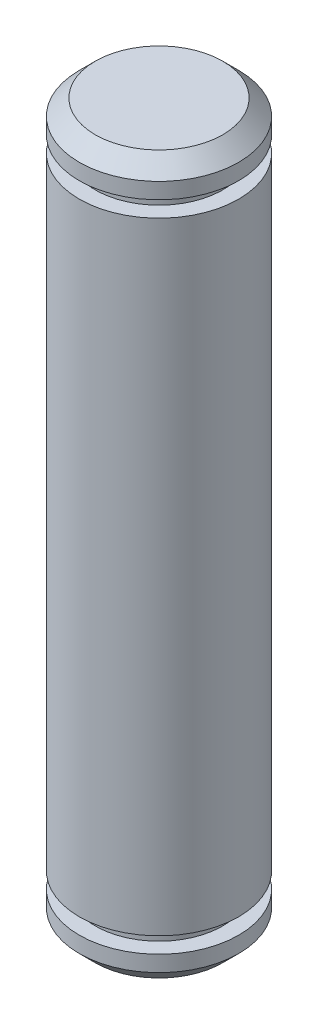
from build123d import *

# Parameters (mm, degrees)
SKETCH1_R           = 5
BOSS_EXTRUDE1_DEPTH = 45
CHAMFER1_SIZE       = 1
CUT_EXTRUDE1_START  = -2
SKETCH2_R           = 6
SKETCH2_R_2         = 4
CUT_EXTRUDE1_DEPTH  = 1
CUT_EXTRUDE2_START  = -42
SKETCH2_2_R         = 6
SKETCH2_2_R_2       = 4
CUT_EXTRUDE2_DEPTH  = 1


with BuildPart() as part:
    # Sketch1 → Boss-Extrude1 (new body)
    with BuildSketch(Plane(origin=(0, 0, 0), x_dir=(1, 0, 0), z_dir=(0, 1, 0))):
        Circle(SKETCH1_R)
    extrude(amount=BOSS_EXTRUDE1_DEPTH)

    # Chamfer1
    chamfer1_edges = [part.edges().sort_by_distance(p)[0] for p in [
        (-5, 45, 0),
        (-5, 0, 0),
    ]]
    chamfer(chamfer1_edges, length=CHAMFER1_SIZE)

    # Sketch2 → Cut-Extrude1 (cut)
    with BuildSketch(Plane.XZ.offset(CUT_EXTRUDE1_START)):
        Circle(SKETCH2_R)
        Circle(SKETCH2_R_2, mode=Mode.SUBTRACT)
    extrude(amount=-CUT_EXTRUDE1_DEPTH, mode=Mode.SUBTRACT)

    # Sketch2<2> → Cut-Extrude2 (cut)
    with BuildSketch(Plane.XZ.offset(CUT_EXTRUDE2_START)):
        Circle(SKETCH2_2_R)
        Circle(SKETCH2_2_R_2, mode=Mode.SUBTRACT)
    extrude(amount=-CUT_EXTRUDE2_DEPTH, mode=Mode.SUBTRACT)


solid = part.part
